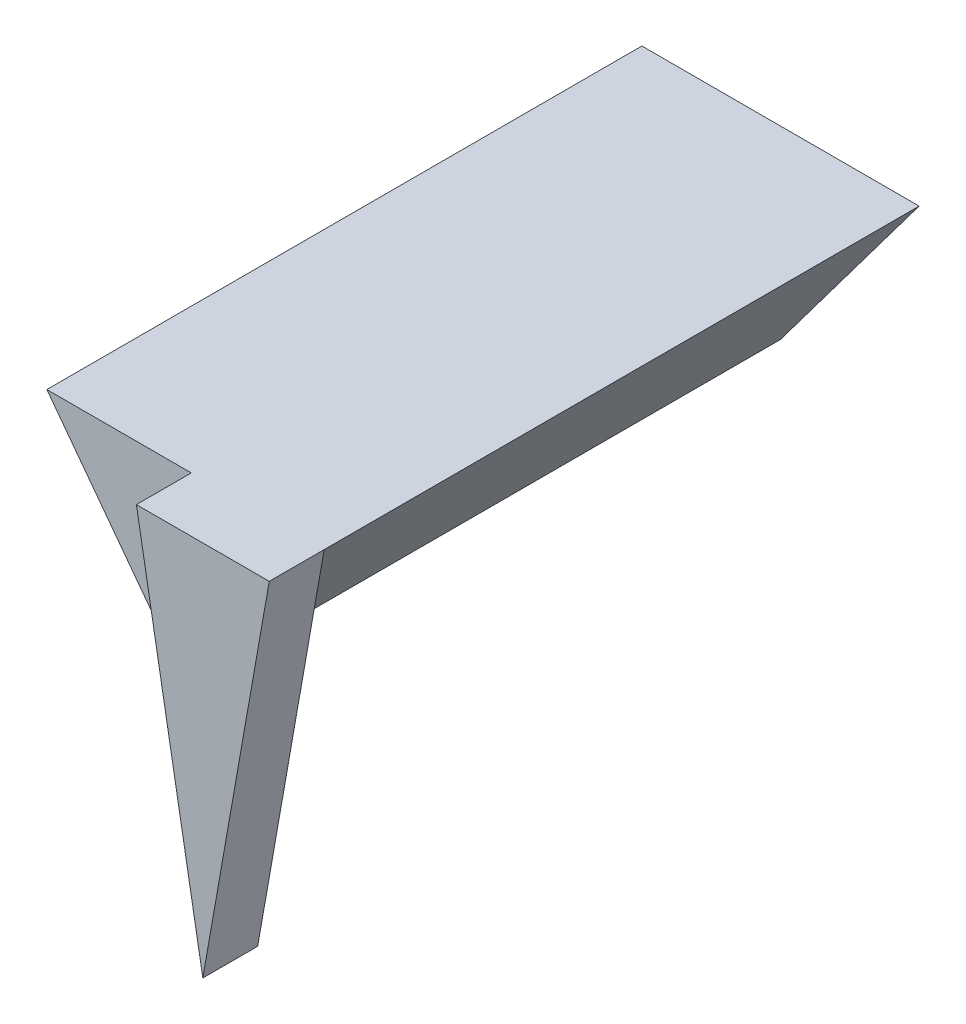
from build123d import *

# Parameters (mm, degrees)
BOSS_EXTRUDE1_DEPTH = 9.5
BOSS_EXTRUDE2_DEPTH = 103


with BuildPart() as part:
    # Sketch1 → Boss-Extrude1 (new body)
    with BuildSketch(Plane.XY):
        Polygon((0, 0), (-11.5, 65.219740926), (11.5, 65.219740926), align=None)
    extrude(amount=-BOSS_EXTRUDE1_DEPTH)

    # Sketch2 → Boss-Extrude2 (add)
    with BuildSketch(Plane(origin=(0, 0, -9.5), x_dir=(-1, 0, 0), z_dir=(0, 0, -1))):
        Polygon((-11.5, 65.219740926), (36.5, 65.219740926), (12.5, 33.219740926), align=None)
    extrude(amount=BOSS_EXTRUDE2_DEPTH)


solid = part.part
